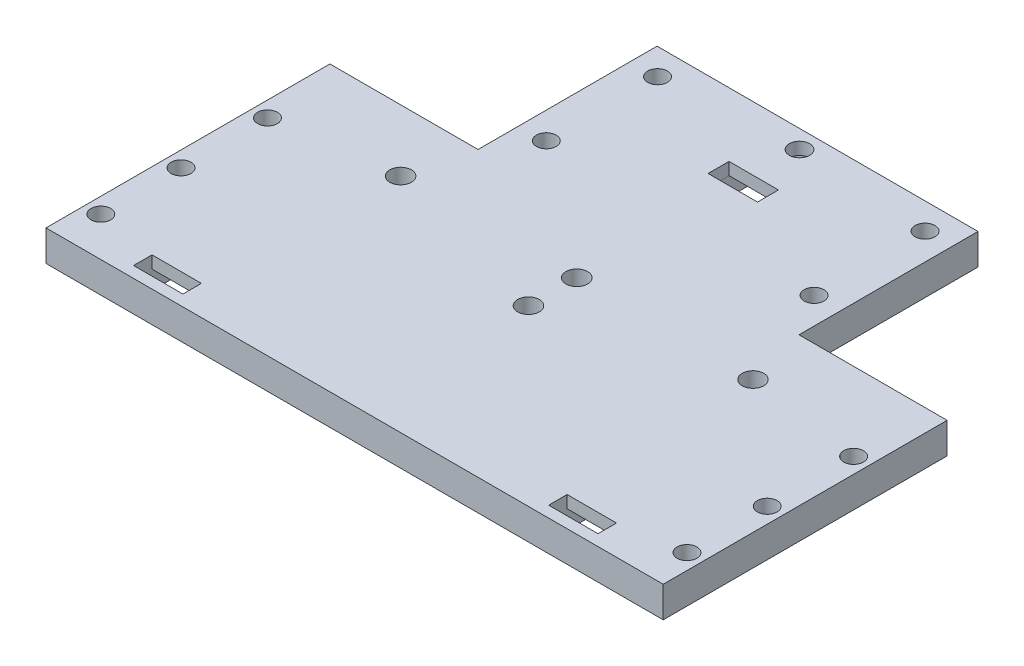
from build123d import *

# Parameters (mm, degrees)
CROQUIS1_R                                           = 1.5
CROQUIS1_R_2                                         = 1.75
CROQUIS1_W                                           = 8.011123414
CROQUIS1_H                                           = 3.391601998
CROQUIS1_R_3                                         = 1.642596358
SALIENTE_EXTRUIR1_DEPTH                              = 5
REFRENTADO_PARA_TORNILLO_TAP_N_CON_CABEZ_D           = 3.2
REFRENTADO_PARA_TORNILLO_TAP_N_CON_CABEZ_CSINK_D     = 4.72
REFRENTADO_PARA_TORNILLO_TAP_N_CON_CABEZ_CSINK_ANGLE = 90
REFRENTADO_PARA_TORNILLO_TAP_N_CON_C_2_D             = 3.2
REFRENTADO_PARA_TORNILLO_TAP_N_CON_C_2_CSINK_D       = 6.72
REFRENTADO_PARA_TORNILLO_TAP_N_CON_C_2_CSINK_ANGLE   = 90
CROQUIS7_W                                           = 8
CROQUIS7_H                                           = 13.5
CORTAR_EXTRUIR1_DEPTH                                = 3
CROQUIS8_W                                           = 8
CROQUIS8_H                                           = 2.993534549
CORTAR_EXTRUIR2_DEPTH                                = 10


with BuildPart() as part:
    # Croquis1 → Saliente-Extruir1 (new body)
    with BuildSketch(Plane(origin=(0, 0, 0), x_dir=(1, 0, 0), z_dir=(0, 1, 0))):
        Polygon((-26, 8.5), (-50, 8.5), (-50, -37.5), (50, -37.5), (50, 8.5), (26, 8.5), (26, 37.5), (-26, 37.5), align=None)
        with Locations(Location((-47.484488335, -31.135629499, 0), (0, 0, 270))):
            Circle(CROQUIS1_R, mode=Mode.SUBTRACT)
        with Locations(Location((-47.484488335, -18.135629499, 0), (0, 0, 270))):
            Circle(CROQUIS1_R, mode=Mode.SUBTRACT)
        with Locations(Location((0, -9.329285485, 0), (0, 0, 270))):
            Circle(CROQUIS1_R_2, mode=Mode.SUBTRACT)
        with Locations(Location((47.484488335, -31.135629499, 0), (0, 0, 270))):
            Circle(CROQUIS1_R, mode=Mode.SUBTRACT)
        with Locations(Location((47.484488335, -18.135629499, 0), (0, 0, 270))):
            Circle(CROQUIS1_R, mode=Mode.SUBTRACT)
        with Locations(Location((-47.484488335, -4.135629499, 0), (0, 0, 270))):
            Circle(CROQUIS1_R, mode=Mode.SUBTRACT)
        with Locations(Location((-28.55, -1.504051409, 0), (0, 0, 270))):
            Circle(CROQUIS1_R_2, mode=Mode.SUBTRACT)
        with Locations(Location((0, -1.504051409, 0), (0, 0, 270))):
            Circle(CROQUIS1_R_2, mode=Mode.SUBTRACT)
        with Locations(Location((-21.691369475, 15.250012243, 0), (0, 0, 270))):
            Circle(CROQUIS1_R, mode=Mode.SUBTRACT)
        with Locations(Location((-21.670375076, 33.25, 0), (0, 0, 270))):
            Circle(CROQUIS1_R, mode=Mode.SUBTRACT)
        with Locations(Location((21.691369475, 15.250012243, 0), (0, 0, 270))):
            Circle(CROQUIS1_R, mode=Mode.SUBTRACT)
        with Locations(Location((28.55, -1.504051409, 0), (0, 0, 270))):
            Circle(CROQUIS1_R_2, mode=Mode.SUBTRACT)
        with Locations(Location((47.484488335, -4.135629499, 0), (0, 0, 270))):
            Circle(CROQUIS1_R, mode=Mode.SUBTRACT)
        with Locations((0.009339911, 25.460705384)):
            Rectangle(CROQUIS1_W, CROQUIS1_H, mode=Mode.SUBTRACT)
        with Locations(Location((0.044450606, 34.53510664, 0), (0, 0, 270))):
            Circle(CROQUIS1_R_3, mode=Mode.SUBTRACT)
        with Locations(Location((21.670375076, 33.25, 0), (0, 0, 270))):
            Circle(CROQUIS1_R, mode=Mode.SUBTRACT)
    extrude(amount=SALIENTE_EXTRUIR1_DEPTH)

    # Refrentado para tornillo tap_n con cabez (through all)
    with Locations(Plane(origin=(47.484488335, 0, 4.135629499), x_dir=(0, 0, -1), z_dir=(0, -1, 0))):
        with Locations((0, 0), (-14, 0), (-27, 0), (-27, -94.96897667), (-14, -94.96897667), (0, -94.96897667), (19.385641742, -69.17585781), (19.385641742, -25.79311886), (37.385629499, -25.814113259), (38.670736139, -47.440037729), (37.385629499, -69.154863411)):
            CounterSinkHole(REFRENTADO_PARA_TORNILLO_TAP_N_CON_CABEZ_D / 2, REFRENTADO_PARA_TORNILLO_TAP_N_CON_CABEZ_CSINK_D / 2, counter_sink_angle=REFRENTADO_PARA_TORNILLO_TAP_N_CON_CABEZ_CSINK_ANGLE)

    # Refrentado para tornillo tap_n con c 2 (through all)
    with Locations(Plane(origin=(28.55, 0, 1.504051409), x_dir=(0, 0, -1), z_dir=(0, -1, 0))):
        with Locations((0, 0), (-7.825234076, -28.55), (0, -28.55), (0, -57.1)):
            CounterSinkHole(REFRENTADO_PARA_TORNILLO_TAP_N_CON_C_2_D / 2, REFRENTADO_PARA_TORNILLO_TAP_N_CON_C_2_CSINK_D / 2, counter_sink_angle=REFRENTADO_PARA_TORNILLO_TAP_N_CON_C_2_CSINK_ANGLE)

    # Croquis7 → Cortar-Extruir1 (cut)
    with BuildSketch(Plane.XZ):
        with Locations((-33.626890672, 28.94005161)):
            Rectangle(CROQUIS7_W, CROQUIS7_H)
        with Locations((0, -30.4)):
            Rectangle(CROQUIS7_W, CROQUIS7_H)
        with Locations((33.626890672, 28.94005161)):
            Rectangle(CROQUIS7_W, CROQUIS7_H)
    extrude(amount=-CORTAR_EXTRUIR1_DEPTH, mode=Mode.SUBTRACT)

    # Croquis8 → Cortar-Extruir2 (cut)
    with BuildSketch(Plane.XZ.offset(-3)):
        with Locations((-33.626890672, 34.193284336)):
            Rectangle(CROQUIS8_W, CROQUIS8_H)
        with Locations((33.626890672, 34.193284336)):
            Rectangle(CROQUIS8_W, CROQUIS8_H)
    extrude(amount=-CORTAR_EXTRUIR2_DEPTH, mode=Mode.SUBTRACT)


solid = part.part
